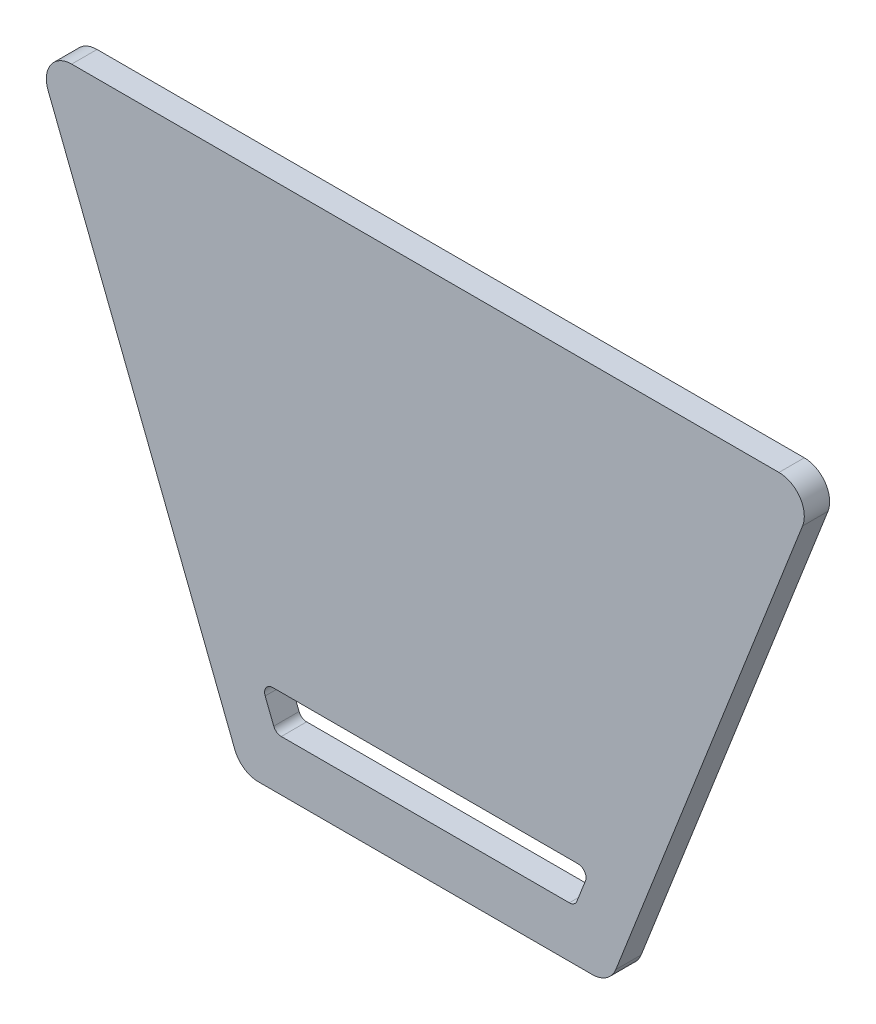
from build123d import *

# Parameters (mm, degrees)
EXTRUDE1_DEPTH = 3.175
EXTRUDE2_DEPTH = 94.295303002


with BuildPart() as part:
    # Sketch1 → Extrude1 (new body)
    with BuildSketch(Plane.XY):
        with BuildLine():
            Line((-18.257091065, 0), (2.640813879, 0))
            ThreePointArc((2.640813879, 0), (4.430938656, 0.552772267), (5.59773661, 2.018612104))
            Line((5.59773661, 2.018612104), (28.983052402, 61.815650828))
            ThreePointArc((28.983052402, 61.815650828), (28.648357405, 64.762163501), (26.026129672, 66.147038724))
            Line((26.026129672, 66.147038724), (-18.257091065, 66.147038724))
            Line((-18.257091065, 66.147038724), (-18.257091065, 0))
        make_face()
    extrude(amount=-EXTRUDE1_DEPTH)

    # Mirror1: part across plane


with BuildPart() as part_1:
    add(part.part)
    add(part.part.mirror(Plane(origin=(-18.257091065, 66.147038724, -3.175), x_dir=(0, 0, 1), z_dir=(-1, 0, 0))))

    # Sketch2 → Extrude2 (cut, through all)
    with BuildSketch(Plane.XY):
        with BuildLine():
            Line((0.725945487, 6.995955873), (1.798751091, 9.739155873))
            ThreePointArc((1.798751091, 9.739155873), (1.691648692, 10.682039928), (0.852535818, 11.1252))
            Line((0.852535818, 11.1252), (-37.366717948, 11.1252))
            ThreePointArc((-37.366717948, 11.1252), (-38.205830822, 10.682039928), (-38.312933221, 9.739155873))
            Line((-38.312933221, 9.739155873), (-37.240127617, 6.995955873))
            ThreePointArc((-37.240127617, 6.995955873), (-36.866752272, 6.526887125), (-36.293912343, 6.35))
            Line((-36.293912343, 6.35), (-0.220269787, 6.35))
            ThreePointArc((-0.220269787, 6.35), (0.352570142, 6.526887125), (0.725945487, 6.995955873))
        make_face()
    extrude(amount=-EXTRUDE2_DEPTH, mode=Mode.SUBTRACT)


solid = part_1.part
